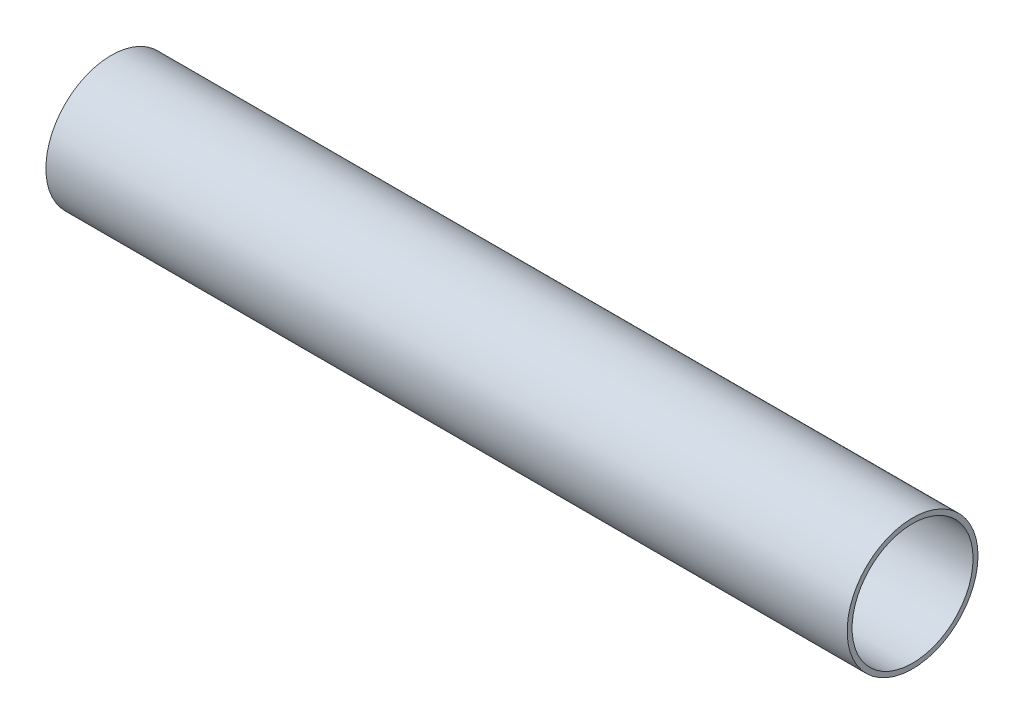
from build123d import *

# Parameters (mm, degrees)
SKETCH1_R           = 17.171437949
SKETCH1_R_2         = 15.875
BOSS_EXTRUDE1_DEPTH = 105.156


with BuildPart() as part:
    # Sketch1 → Boss-Extrude1 (new, symmetric)
    with BuildSketch(Plane(origin=(0, 0, 0), x_dir=(0, 0, -1), z_dir=(1, 0, 0))):
        Circle(SKETCH1_R)
        Circle(SKETCH1_R_2, mode=Mode.SUBTRACT)
    extrude(amount=BOSS_EXTRUDE1_DEPTH, both=True)


solid = part.part
